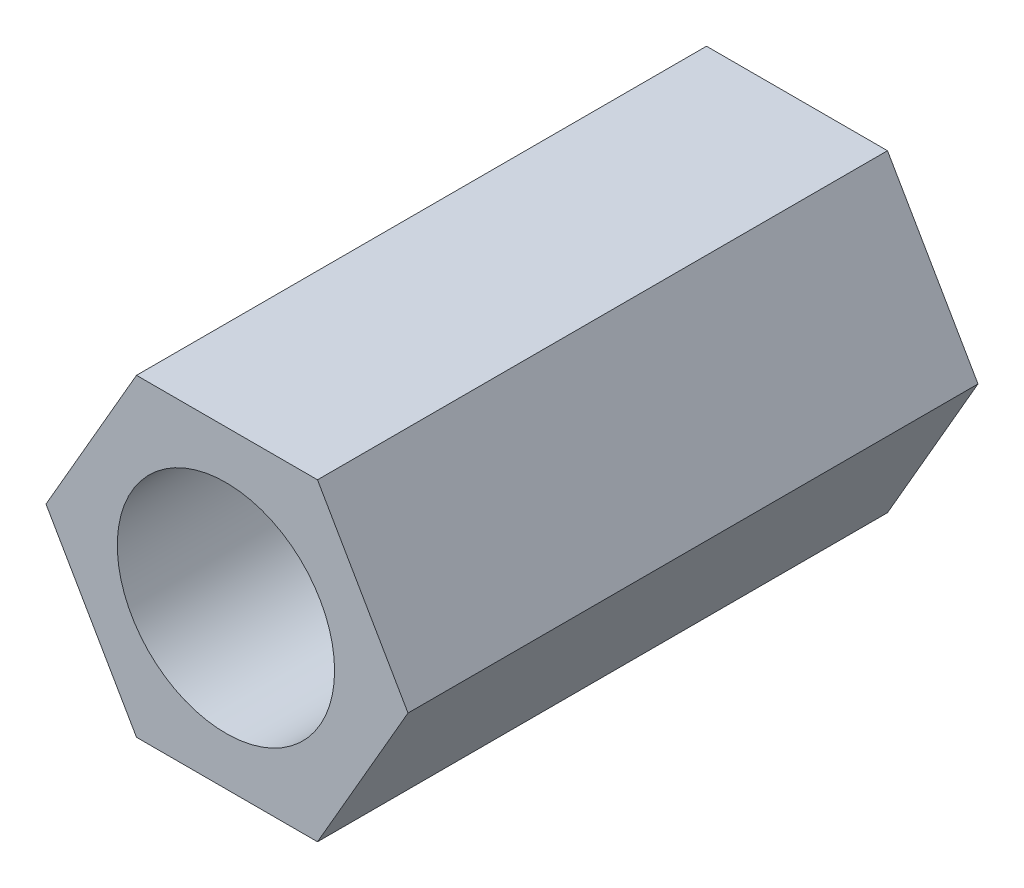
from build123d import *

# Parameters (mm, degrees)
BOSS_EXTRUDE1_DEPTH = 40


with BuildPart() as part:
    # Sketch1 → Boss-Extrude1 (new body)
    with BuildSketch(Plane.XY.offset(40)):
        Polygon((-12.701705922, 0), (-6.350852961, -11), (6.350852961, -11), (12.701705922, 0), (6.350852961, 11), (-6.350852961, 11), align=None)
    extrude(amount=-BOSS_EXTRUDE1_DEPTH)

    # Sketch4 → Cut-Revolve1 (revolve, cut)
    with BuildSketch(Plane(origin=(0, 0, 0), x_dir=(1, 0, 0), z_dir=(0, 1, 0))):
        with BuildLine():
            Line((-0.074824701, 0), (-0.074824701, -40))
            Line((-0.074824701, -40), (7.55, -40))
            Line((7.55, -40), (7.55, -25.17))
            Line((7.55, -25.17), (5, -25.17))
            Line((5, -25.17), (5, -21.69))
            ThreePointArc((5, -21.69), (4.689674525, -20.619953272), (3.855, -19.881969303))
            ThreePointArc((3.855, -19.881969303), (2.28150675, -18.186091288), (2.314346639, -15.872910622))
            ThreePointArc((2.314346639, -15.872910622), (4.799929708, -8.091856091), (5.915634782, 0))
            Line((5.915634782, 0), (-0.074824701, 0))
        make_face()
    revolve(axis=Axis((-0.074824701, 0, 0.317458212), (0, 0, 1)), mode=Mode.SUBTRACT)


solid = part.part
